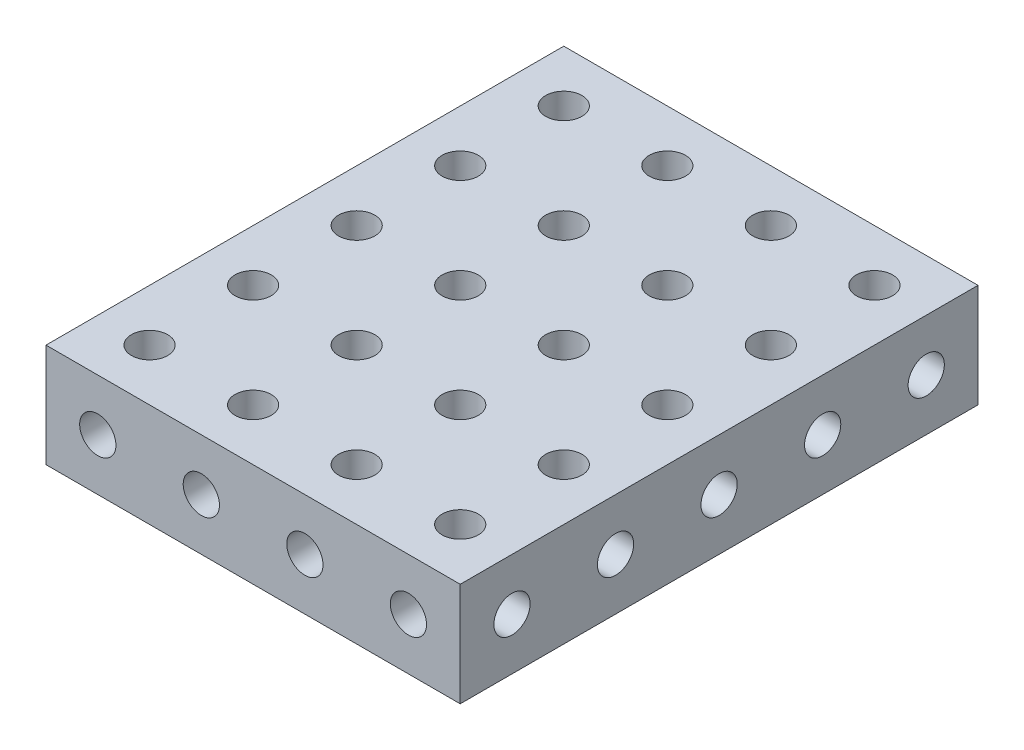
from build123d import *

# Parameters (mm, degrees)
ESQUISSE1_W             = 50
ESQUISSE1_H             = 10
BOSS_EXTRU_1_DEPTH      = 40
ESQUISSE2_R             = 1.75
ENL_V_MAT_EXTRU_1_DEPTH = 65.807406984
ESQUISSE3_R             = 1.75
ENL_V_MAT_EXTRU_2_DEPTH = 65.807406984
ESQUISSE4_R             = 1.75
ENL_V_MAT_EXTRU_3_DEPTH = 40


with BuildPart() as part:
    # Esquisse1 → Boss.-Extru.1 (new body)
    with BuildSketch(Plane(origin=(0, 0, 0), x_dir=(0, 0, -1), z_dir=(1, 0, 0))):
        with Locations((25, 5)):
            Rectangle(ESQUISSE1_W, ESQUISSE1_H)
    extrude(amount=BOSS_EXTRU_1_DEPTH)

    # Esquisse2 → Enlèv. mat.-Extru.1 (cut, through all)
    with BuildSketch(Plane(origin=(0, 10, 0), x_dir=(1, 0, 0), z_dir=(0, 1, 0))):
        with Locations(Location((5, 45, 0), (0, 0, 270))):
            Circle(ESQUISSE2_R)
        with Locations(Location((15, 45, 0), (0, 0, 270))):
            Circle(ESQUISSE2_R)
        with Locations(Location((25, 45, 0), (0, 0, 270))):
            Circle(ESQUISSE2_R)
        with Locations(Location((35, 45, 0), (0, 0, 270))):
            Circle(ESQUISSE2_R)
        with Locations(Location((5, 35, 0), (0, 0, 270))):
            Circle(ESQUISSE2_R)
        with Locations(Location((15, 35, 0), (0, 0, 270))):
            Circle(ESQUISSE2_R)
        with Locations(Location((25, 35, 0), (0, 0, 270))):
            Circle(ESQUISSE2_R)
        with Locations(Location((35, 35, 0), (0, 0, 270))):
            Circle(ESQUISSE2_R)
        with Locations(Location((5, 25, 0), (0, 0, 270))):
            Circle(ESQUISSE2_R)
        with Locations(Location((15, 25, 0), (0, 0, 270))):
            Circle(ESQUISSE2_R)
        with Locations(Location((25, 25, 0), (0, 0, 270))):
            Circle(ESQUISSE2_R)
        with Locations(Location((35, 25, 0), (0, 0, 270))):
            Circle(ESQUISSE2_R)
        with Locations(Location((5, 15, 0), (0, 0, 270))):
            Circle(ESQUISSE2_R)
        with Locations(Location((15, 15, 0), (0, 0, 270))):
            Circle(ESQUISSE2_R)
        with Locations(Location((25, 15, 0), (0, 0, 270))):
            Circle(ESQUISSE2_R)
        with Locations(Location((35, 15, 0), (0, 0, 270))):
            Circle(ESQUISSE2_R)
        with Locations(Location((5, 5, 0), (0, 0, 270))):
            Circle(ESQUISSE2_R)
        with Locations(Location((15, 5, 0), (0, 0, 270))):
            Circle(ESQUISSE2_R)
        with Locations(Location((25, 5, 0), (0, 0, 270))):
            Circle(ESQUISSE2_R)
        with Locations(Location((35, 5, 0), (0, 0, 270))):
            Circle(ESQUISSE2_R)
    extrude(amount=-ENL_V_MAT_EXTRU_1_DEPTH, mode=Mode.SUBTRACT)

    # Esquisse3 → Enlèv. mat.-Extru.2 (cut, through all)
    with BuildSketch(Plane.XY):
        with Locations((5, 5)):
            Circle(ESQUISSE3_R)
        with Locations((15, 5)):
            Circle(ESQUISSE3_R)
        with Locations((25, 5)):
            Circle(ESQUISSE3_R)
        with Locations((35, 5)):
            Circle(ESQUISSE3_R)
    extrude(amount=-ENL_V_MAT_EXTRU_2_DEPTH, mode=Mode.SUBTRACT)

    # Esquisse4 → Enlèv. mat.-Extru.3 (cut)
    with BuildSketch(Plane(origin=(40, 0, 0), x_dir=(0, 0, -1), z_dir=(1, 0, 0))):
        with Locations(Location((5, 5, 0), (0, 0, 45))):
            Circle(ESQUISSE4_R)
        with Locations((15, 5)):
            Circle(ESQUISSE4_R)
        with Locations(Location((25, 5, 0), (0, 0, 315))):
            Circle(ESQUISSE4_R)
        with Locations(Location((35, 5, 0), (0, 0, 315))):
            Circle(ESQUISSE4_R)
        with Locations(Location((45, 5, 0), (0, 0, 315))):
            Circle(ESQUISSE4_R)
    extrude(amount=-ENL_V_MAT_EXTRU_3_DEPTH, mode=Mode.SUBTRACT)


solid = part.part
